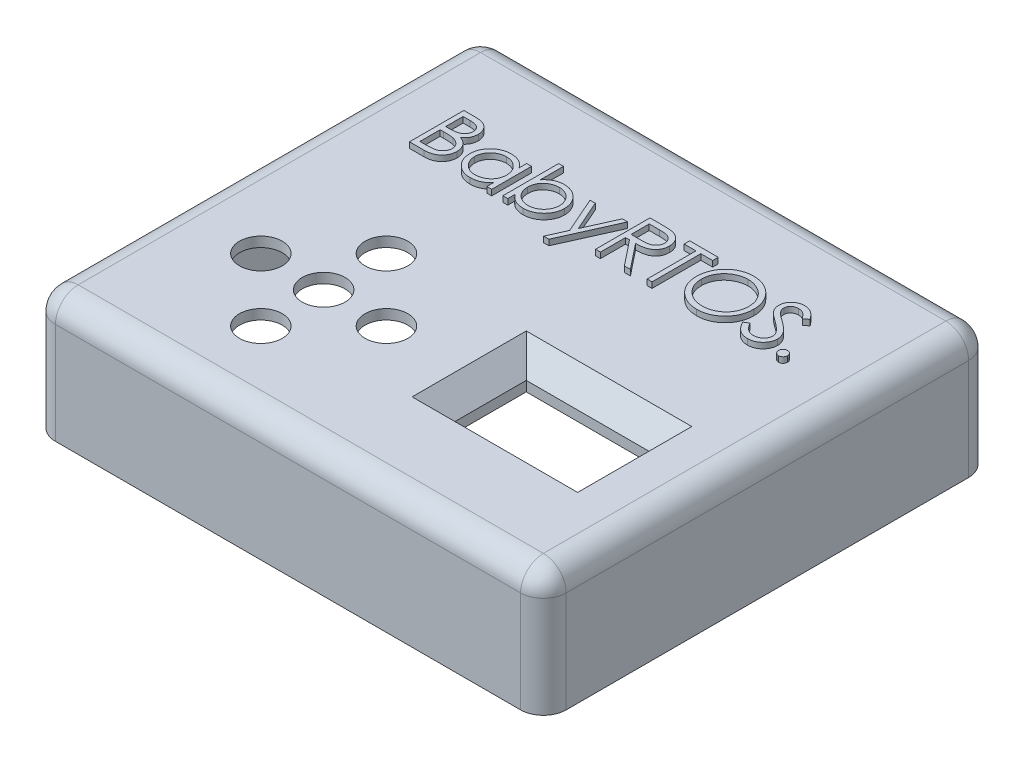
from build123d import *

# Parameters (mm, degrees)
SKETCH1_W               = 89.5
SKETCH1_H               = 78.5
BOSS_EXTRUDE1_DEPTH     = 21.75
FILLET2_R               = 4
SHELL1_T                = -1.75
CUT_EXTRUDE1_DEPTH      = 64.37339745
CUT_EXTRUDE1_DEPTH_BACK = 64.37339745
SKETCH3_W               = 22
SKETCH3_H               = 13
SKETCH3_4_R             = 3.75
CUT_EXTRUDE2_DEPTH      = 64.37339745
SKETCH6_W               = 12
SKETCH6_H               = 13
CUT_EXTRUDE3_DEPTH      = 64.37339745
BOSS_EXTRUDE2_REACH     = 65.373
SKETCH3_5_R             = 1.1
BOSS_EXTRUDE3_REACH     = 65.373
SKETCH7_R               = 1.1
FILLET3_R               = 2
BOSS_EXTRUDE4_DEPTH     = 1


with BuildPart() as part:
    # Sketch1 → Boss-Extrude1 (new body)
    with BuildSketch(Plane(origin=(0, 0, 0), x_dir=(1, 0, 0), z_dir=(0, 1, 0))):
        Rectangle(SKETCH1_W, SKETCH1_H)
    extrude(amount=BOSS_EXTRUDE1_DEPTH)

    # Fillet2
    fillet2_edges = [part.edges().sort_by_distance(p)[0] for p in [
        (44.75, 10.875, -39.25),
        (44.75, 21.75, 0),
        (0, 21.75, 39.25),
        (44.75, 10.875, 39.25),
        (-44.75, 10.875, 39.25),
        (-44.75, 21.75, 0),
        (0, 21.75, -39.25),
        (-44.75, 10.875, -39.25),
    ]]
    fillet(fillet2_edges, radius=FILLET2_R)

    # Sketch4 → Cut-Loft1 section 0
    with BuildSketch(Plane(origin=(0, 21.75, 0), x_dir=(1, 0, 0), z_dir=(0, 1, 0))):
        with BuildLine():
            Line((5.5, -23), (34.5, -23))
            Line((34.5, -23), (34.5, -3))
            Line((34.5, -3), (5.5, -3))
            Line((5.5, -3), (5.5, -23))
        make_face()
    # Sketch5 → Cut-Loft1 section 1
    with BuildSketch(Plane(origin=(0, 17.75, 0), x_dir=(1, 0, 0), z_dir=(0, 1, 0))):
        with BuildLine():
            Line((31, -19.5), (31, -6.5))
            Line((31, -6.5), (9, -6.5))
            Line((9, -6.5), (9, -19.5))
            Line((9, -19.5), (31, -19.5))
        make_face()
    loft(mode=Mode.SUBTRACT)

    # Shell1
    shell1_openings = [part.faces().sort_by_distance(p)[0] for p in [
        (0, 0, 0),
    ]]
    offset(amount=SHELL1_T, openings=shell1_openings, kind=Kind.INTERSECTION)

    # Sketch3 → Cut-Extrude1 (cut, two sides: drawn at the far end of the back side and taken through both)
    with BuildSketch(Plane(origin=(0, 0, 0), x_dir=(1, 0, 0), z_dir=(0, 1, 0)).offset(-CUT_EXTRUDE1_DEPTH_BACK)):
        with Locations((20, -13)):
            Rectangle(SKETCH3_W, SKETCH3_H)
    extrude(amount=CUT_EXTRUDE1_DEPTH + CUT_EXTRUDE1_DEPTH_BACK, mode=Mode.SUBTRACT)

    # Sketch3<4> → Cut-Extrude2 (cut, through all)
    with BuildSketch(Plane(origin=(0, 0, 0), x_dir=(1, 0, 0), z_dir=(0, 1, 0))):
        with Locations((-18.5, -3.5)):
            Circle(SKETCH3_4_R)
        with Locations((-29.5, -14.5)):
            Circle(SKETCH3_4_R)
        with Locations((-18.5, -14.5)):
            Circle(SKETCH3_4_R)
        with Locations((-7.5, -14.5)):
            Circle(SKETCH3_4_R)
        with Locations((-18.5, -25.5)):
            Circle(SKETCH3_4_R)
    extrude(amount=CUT_EXTRUDE2_DEPTH, mode=Mode.SUBTRACT)

    # Sketch6 → Cut-Extrude3 (cut, through all)
    with BuildSketch(Plane(origin=(0, 0, 0), x_dir=(0, 0, -1), z_dir=(1, 0, 0))):
        with Locations((28.5, 6.5)):
            Rectangle(SKETCH6_W, SKETCH6_H)
    extrude(amount=-CUT_EXTRUDE3_DEPTH, mode=Mode.SUBTRACT)

    # Sketch3<5> → Boss-Extrude2 (add, up to next)
    with BuildSketch(Plane(origin=(0, 0, 0), x_dir=(1, 0, 0), z_dir=(0, 1, 0)), mode=Mode.PRIVATE) as boss_extrude2_sk1:
        with BuildLine():
            Line((44.75, 32.125), (41.212355987, 32.125))
            ThreePointArc((41.212355987, 32.125), (36.484745674, 30.984745674), (37.625, 35.712355987))
            Line((37.625, 35.712355987), (37.625, 39.25))
            Line((37.625, 39.25), (39.375, 39.25))
            Line((39.375, 39.25), (39.375, 35.712355987))
            ThreePointArc((39.375, 35.712355987), (40.515254326, 35.015254326), (41.212355987, 33.875))
            Line((41.212355987, 33.875), (44.75, 33.875))
            Line((44.75, 33.875), (44.75, 32.125))
        make_face()
        with Locations((38.5, 33)):
            Circle(SKETCH3_5_R, mode=Mode.SUBTRACT)
    boss_extrude2_tool1 = extrude(boss_extrude2_sk1.sketch, amount=BOSS_EXTRUDE2_REACH, mode=Mode.PRIVATE) - part.part
    boss_extrude2 = boss_extrude2_tool1.solids().sort_by_distance((39.30816, 0, -33.80816))[0]
    add(boss_extrude2)

    # Mirror1: Boss-Extrude2 across plane
    add(boss_extrude2.mirror(Plane.XY))

    # Sketch7 → Boss-Extrude3 (add, up to next)
    with BuildSketch(Plane(origin=(0, 0, 0), x_dir=(1, 0, 0), z_dir=(0, 1, 0)), mode=Mode.PRIVATE) as boss_extrude3_sk1:
        with BuildLine():
            Line((-37.625, -35.712355987), (-37.625, -39.25))
            Line((-37.625, -39.25), (-39.375, -39.25))
            Line((-39.375, -39.25), (-39.375, -35.712355987))
            ThreePointArc((-39.375, -35.712355987), (-40.515254326, -35.015254326), (-41.212355987, -33.875))
            Line((-41.212355987, -33.875), (-44.75, -33.875))
            Line((-44.75, -33.875), (-44.75, -32.125))
            Line((-44.75, -32.125), (-41.212355987, -32.125))
            ThreePointArc((-41.212355987, -32.125), (-36.484745674, -30.984745674), (-37.625, -35.712355987))
        make_face()
        with Locations((-38.5, -33)):
            Circle(SKETCH7_R, mode=Mode.SUBTRACT)
    boss_extrude3_tool1 = extrude(boss_extrude3_sk1.sketch, amount=BOSS_EXTRUDE3_REACH, mode=Mode.PRIVATE) - part.part
    add(boss_extrude3_tool1.solids().sort_by_distance((-39.30816, 0, 33.80816))[0])

    # Fillet3
    fillet3_edges = [part.edges().sort_by_distance(p)[0] for p in [
        (-43.875, 0, -22.5),
        (-43.875, 0, -34.5),
    ]]
    fillet(fillet3_edges, radius=FILLET3_R)

    # Sketch8 → Boss-Extrude4 (add)
    # profile 1 of 9: a face of its own
    with BuildSketch(Plane(origin=(0, 21.75, 0), x_dir=(1, 0, 0), z_dir=(0, 1, 0))):
        with BuildLine():
            Line((-32.428807867, 23.991700279), (-30.570364358, 23.991700279))
            add(Edge.make_bspline(
                [(-30.570364358, 23.991700279), (-30.479391142, 23.991221987), (-30.303062409, 23.990294938), (-30.046650928, 23.975917274), (-29.806488093, 23.956313001), (-29.582504256, 23.92520682), (-29.374802916, 23.887673484), (-29.182758131, 23.842220684), (-29.006980591, 23.787719686), (-28.797123787, 23.701052306), (-28.557853988, 23.572265684), (-28.298778363, 23.381960089), (-28.07724254, 23.1491896), (-27.886235491, 22.886618945), (-27.73437673, 22.597778023), (-27.62451457, 22.289551231), (-27.554960638, 21.965914204), (-27.547807542, 21.743728127), (-27.544192483, 21.631438861)],
                knots=[0, 0, 0, 0, 1.001505555, 1.941167018, 2.826882275, 3.653841531, 4.429895133, 5.150066043, 5.825578002, 6.45369114, 7.647487171, 8.808567382, 9.977351308, 11.170798116, 12.373658725, 13.556498008, 14.765093433, 16, 16, 16, 16], degree=3))
            add(Edge.make_bspline(
                [(-27.544192483, 21.631438861), (-27.547167599, 21.526248692), (-27.553013982, 21.319540089), (-27.608919634, 21.017205406), (-27.696442596, 20.729411018), (-27.818104738, 20.45720724), (-27.976225171, 20.206744336), (-28.163618167, 19.976001847), (-28.389705751, 19.774749328), (-28.559096282, 19.662237572), (-28.645138997, 19.605086698)],
                knots=[0, 0, 0, 0, 1.044552857, 2.05264487, 3.044412934, 4.028983338, 5.005914585, 5.980388656, 6.974128949, 8, 8, 8, 8], degree=3))
            add(Edge.make_bspline(
                [(-28.645138997, 19.605086698), (-28.536933833, 19.563544093), (-28.329910551, 19.484062801), (-28.045015046, 19.343540574), (-27.799556217, 19.190699402), (-27.591646842, 19.023789152), (-27.413835081, 18.843878746), (-27.258569575, 18.648330185), (-27.126086693, 18.434592565), (-27.012567951, 18.204894373), (-26.923988836, 17.961581055), (-26.857651554, 17.706934872), (-26.819640139, 17.441868939), (-26.814230915, 17.261478014), (-26.811500175, 17.170411217)],
                knots=[0, 0, 0, 0, 1.27268992, 2.434971085, 3.483601985, 4.442670788, 5.356604649, 6.2567628, 7.179492994, 8.113709626, 9.066344395, 10.018646069, 10.999752585, 12, 12, 12, 12], degree=3))
            add(Edge.make_bspline(
                [(-26.811500175, 17.170411217), (-26.814158592, 17.077428515), (-26.819389101, 16.894482444), (-26.857978881, 16.625727399), (-26.923317951, 16.368892723), (-27.013318714, 16.12231719), (-27.13078187, 15.886477824), (-27.273732973, 15.661107441), (-27.444180299, 15.448470442), (-27.634851393, 15.24620401), (-27.85055766, 15.06433696), (-28.083282679, 14.902369216), (-28.335957307, 14.769166004), (-28.604431662, 14.657271688), (-28.891717408, 14.571799241), (-29.196524504, 14.512002451), (-29.518590068, 14.4717116), (-29.739596605, 14.468399064), (-29.852936473, 14.466700279)],
                knots=[0, 0, 0, 0, 0.978564426, 1.925352924, 2.850884081, 3.763762016, 4.682927383, 5.618979971, 6.567305752, 7.547517671, 8.540179244, 9.531824382, 10.526200242, 11.540722885, 12.589160233, 13.674978461, 14.80764778, 16, 16, 16, 16], degree=3))
            Line((-29.852936473, 14.466700279), (-32.428807867, 14.466700279))
            Line((-32.428807867, 14.466700279), (-32.428807867, 23.991700279))
        make_face()
        with BuildLine():
            Line((-31.574000175, 23.014777203), (-31.574000175, 19.961892587))
            Line((-31.574000175, 19.961892587), (-30.999676257, 19.961892587))
            add(Edge.make_bspline(
                [(-30.999676257, 19.961892587), (-30.915723464, 19.962980949), (-30.753509559, 19.965083886), (-30.518596126, 19.971107815), (-30.300541612, 19.987975347), (-30.099722409, 20.004838032), (-29.916454758, 20.032255302), (-29.751144678, 20.064891008), (-29.601197782, 20.099406629), (-29.428279447, 20.158106447), (-29.232138066, 20.244859263), (-29.023042261, 20.379493331), (-28.838707741, 20.539851749), (-28.68304968, 20.724884295), (-28.555655606, 20.928627272), (-28.467171853, 21.147829854), (-28.407171744, 21.377028928), (-28.401751934, 21.534377173), (-28.399000175, 21.614266385)],
                knots=[0, 0, 0, 0, 1.156816544, 2.235205308, 3.236616184, 4.169592532, 5.011045266, 5.787822928, 6.49130361, 7.128639758, 8.301311294, 9.436451833, 10.541879658, 11.654887649, 12.756523258, 13.837046038, 14.901820046, 16, 16, 16, 16], degree=3))
            add(Edge.make_bspline(
                [(-28.399000175, 21.614266385), (-28.400432137, 21.667132235), (-28.403241086, 21.770834372), (-28.426246145, 21.922007971), (-28.465346473, 22.064185612), (-28.515568514, 22.199315727), (-28.585750588, 22.323172976), (-28.668382585, 22.440039816), (-28.76822007, 22.545936367), (-28.881859614, 22.644913359), (-29.012511652, 22.732664538), (-29.160098239, 22.809519758), (-29.326616132, 22.871407157), (-29.509258973, 22.925607544), (-29.710838147, 22.963675686), (-29.929027467, 22.995389548), (-30.165614095, 23.011535082), (-30.329294696, 23.013672391), (-30.413904021, 23.014777203)],
                knots=[0, 0, 0, 0, 0.91205012, 1.789085906, 2.630437955, 3.453916878, 4.269457761, 5.079663411, 5.91843418, 6.774407191, 7.675494373, 8.627863946, 9.638891023, 10.736472738, 11.911756761, 13.175263542, 14.539845004, 16, 16, 16, 16], degree=3))
            Line((-30.413904021, 23.014777203), (-31.574000175, 23.014777203))
        make_face(mode=Mode.SUBTRACT)
        with BuildLine():
            Line((-31.574000175, 18.98496951), (-31.574000175, 15.443623356))
            Line((-31.574000175, 15.443623356), (-30.356662435, 15.443623356))
            add(Edge.make_bspline(
                [(-30.356662435, 15.443623356), (-30.269525215, 15.444667698), (-30.101579711, 15.446680527), (-29.859097078, 15.453251565), (-29.634353059, 15.468198401), (-29.428373204, 15.491727463), (-29.23893333, 15.517250243), (-29.068306009, 15.551570943), (-28.915108104, 15.590892757), (-28.737468738, 15.651673612), (-28.537434191, 15.746097579), (-28.321867503, 15.888467009), (-28.130207581, 16.05807544), (-27.96745184, 16.254374571), (-27.834066492, 16.467819825), (-27.737032718, 16.694093955), (-27.677186172, 16.929458141), (-27.669941269, 17.089931837), (-27.666307867, 17.170411217)],
                knots=[0, 0, 0, 0, 1.160039823, 2.235823828, 3.228722157, 4.157150951, 4.99529583, 5.772374946, 6.472645482, 7.099169577, 8.269452708, 9.405989375, 10.527446681, 11.663510218, 12.788923519, 13.866172445, 14.929861265, 16, 16, 16, 16], degree=3))
            add(Edge.make_bspline(
                [(-27.666307867, 17.170411217), (-27.667059265, 17.220739522), (-27.668549942, 17.320584333), (-27.691030615, 17.467312383), (-27.723725504, 17.609441367), (-27.765993192, 17.747357218), (-27.827550456, 17.878566478), (-27.899413982, 18.005664158), (-27.983673225, 18.12881827), (-28.114966276, 18.284517331), (-28.30593432, 18.463905773), (-28.577279187, 18.639539976), (-28.885813798, 18.781184365), (-29.109590047, 18.841326511), (-29.225187074, 18.87239439)],
                knots=[0, 0, 0, 0, 0.723448775, 1.435228256, 2.130040452, 2.821711965, 3.505591119, 4.210454504, 4.921174351, 5.648778258, 7.137944449, 8.670945889, 10.280296675, 12, 12, 12, 12], degree=3))
            add(Edge.make_bspline(
                [(-29.225187074, 18.87239439), (-29.271530542, 18.881797154), (-29.37201274, 18.902184286), (-29.535863369, 18.923704536), (-29.722923127, 18.942877164), (-29.933623957, 18.957058957), (-30.168232439, 18.971718051), (-30.427249625, 18.977418957), (-30.709617745, 18.984220514), (-30.905539845, 18.984713458), (-31.007308468, 18.98496951)],
                knots=[0, 0, 0, 0, 0.634451884, 1.375622551, 2.216452059, 3.157844607, 4.20941857, 5.370758133, 6.634282058, 8, 8, 8, 8], degree=3))
            Line((-31.007308468, 18.98496951), (-31.574000175, 18.98496951))
        make_face(mode=Mode.SUBTRACT)
    # profile 2 of 9: a face of its own
    with BuildSketch(Plane(origin=(0, 21.75, 0), x_dir=(1, 0, 0), z_dir=(0, 1, 0))):
        with BuildLine():
            Line((-18.019192483, 21.427277203), (-18.019192483, 14.466700279))
            Line((-18.019192483, 14.466700279), (-18.874000175, 14.466700279))
            Line((-18.874000175, 14.466700279), (-18.874000175, 15.67068165))
            add(Edge.make_bspline(
                [(-18.874000175, 15.67068165), (-18.970389884, 15.561716755), (-19.158495612, 15.349070392), (-19.472660369, 15.071261051), (-19.805676625, 14.841631476), (-20.155928077, 14.656166348), (-20.52309844, 14.516850824), (-20.906373791, 14.417828491), (-21.305910478, 14.354163839), (-21.578740101, 14.347806522), (-21.716998973, 14.344584895)],
                knots=[0, 0, 0, 0, 1.074387032, 2.096679803, 3.090159297, 4.057316773, 5.018401886, 5.985159533, 6.978961417, 8, 8, 8, 8], degree=3))
            add(Edge.make_bspline(
                [(-21.716998973, 14.344584895), (-21.839920333, 14.347922379), (-22.082326698, 14.354504047), (-22.438912972, 14.405564316), (-22.782064022, 14.48756265), (-23.112104109, 14.601592928), (-23.426897591, 14.752852164), (-23.729139711, 14.933939418), (-24.01726468, 15.149587677), (-24.286880797, 15.396116525), (-24.535162169, 15.663891455), (-24.753043204, 15.949493265), (-24.934706943, 16.251686963), (-25.086617305, 16.566646475), (-25.203628786, 16.896796363), (-25.28519989, 17.240994941), (-25.336200677, 17.59883524), (-25.342779624, 17.842510656), (-25.34611556, 17.96606927)],
                knots=[0, 0, 0, 0, 1.033919861, 2.038935746, 3.024066025, 3.998881131, 4.97069526, 5.957263378, 6.95902576, 7.993208707, 9.027059324, 10.027763471, 11.009749337, 11.988697705, 12.965288445, 13.950418724, 14.960734635, 16, 16, 16, 16], degree=3))
            add(Edge.make_bspline(
                [(-25.34611556, 17.96606927), (-25.342705687, 18.087074063), (-25.335964554, 18.326294012), (-25.285745434, 18.678116754), (-25.201296761, 19.016984307), (-25.082784404, 19.341805702), (-24.930814512, 19.652973981), (-24.745953076, 19.950709221), (-24.528186743, 20.235831653), (-24.277128407, 20.50163692), (-24.005163068, 20.747165877), (-23.714218593, 20.960550494), (-23.411532378, 21.144837061), (-23.092409471, 21.290851164), (-22.761573278, 21.408985942), (-22.416078544, 21.490718519), (-22.057362747, 21.538880515), (-21.813820766, 21.545854894), (-21.690286233, 21.549392587)],
                knots=[0, 0, 0, 0, 1.020392517, 2.01726096, 2.990465484, 3.961182959, 4.928053699, 5.906110375, 6.912531644, 7.948652711, 8.985773172, 9.998621852, 10.987621588, 11.969261332, 12.953316658, 13.946091881, 14.958173133, 16, 16, 16, 16], degree=3))
            add(Edge.make_bspline(
                [(-21.690286233, 21.549392587), (-21.548228045, 21.545479849), (-21.269658643, 21.537807154), (-20.862184561, 21.473955018), (-20.476709231, 21.366081761), (-20.110257031, 21.219349141), (-19.764143878, 21.024362243), (-19.44164647, 20.778399634), (-19.139389691, 20.483012547), (-18.964183326, 20.256125837), (-18.874000175, 20.139341505)],
                knots=[0, 0, 0, 0, 1.038897134, 2.037228247, 3.008116434, 3.962042015, 4.918381754, 5.904844433, 6.921570401, 8, 8, 8, 8], degree=3))
            Line((-18.874000175, 20.139341505), (-18.874000175, 21.427277203))
            Line((-18.874000175, 21.427277203), (-18.019192483, 21.427277203))
        make_face()
        with BuildLine():
            add(Edge.make_bspline(
                [(-21.678837915, 20.694584895), (-21.803790506, 20.690139066), (-22.050427046, 20.681363708), (-22.412496795, 20.612855839), (-22.758971157, 20.498869908), (-23.088117259, 20.342981305), (-23.394735763, 20.146960243), (-23.668766396, 19.909865622), (-23.912450462, 19.638166319), (-24.117396524, 19.333088433), (-24.284466376, 19.006032342), (-24.40194237, 18.664154407), (-24.479419393, 18.313620861), (-24.487334724, 18.075869552), (-24.491307867, 17.956529005)],
                knots=[0, 0, 0, 0, 1.031046209, 2.035121221, 3.029706178, 4.034933723, 5.034054252, 6.02443088, 7.017295772, 8.038157696, 9.050218397, 10.03989886, 11.016116709, 12, 12, 12, 12], degree=3))
            add(Edge.make_bspline(
                [(-24.491307867, 17.956529005), (-24.486232693, 17.837901642), (-24.476102238, 17.601111895), (-24.403302134, 17.250100468), (-24.281164765, 16.908141968), (-24.114498865, 16.578138836), (-23.905801694, 16.271749249), (-23.663897575, 15.994870772), (-23.386447167, 15.756774107), (-23.079123022, 15.557463282), (-22.750897046, 15.396456707), (-22.405727561, 15.284427359), (-22.050103145, 15.212097828), (-21.808297865, 15.203649216), (-21.686470127, 15.199392587)],
                knots=[0, 0, 0, 0, 0.979072187, 1.954306742, 2.945804271, 3.96968567, 4.997920485, 5.998718438, 6.996577872, 8.005894225, 9.015743152, 10.005417472, 10.995077863, 12, 12, 12, 12], degree=3))
            add(Edge.make_bspline(
                [(-21.686470127, 15.199392587), (-21.562790716, 15.20391006), (-21.316804634, 15.212894867), (-20.953660722, 15.281696024), (-20.60124943, 15.395366826), (-20.26437133, 15.552935163), (-19.950546716, 15.748217682), (-19.668884635, 15.97683698), (-19.430716178, 16.242729216), (-19.22880629, 16.534946564), (-19.070486049, 16.855291354), (-18.955162631, 17.196379402), (-18.886980216, 17.558222581), (-18.87838668, 17.805502267), (-18.874000175, 17.931724318)],
                knots=[0, 0, 0, 0, 1.01762866, 2.023962475, 3.030623092, 4.058876274, 5.077231937, 6.066672613, 7.034107872, 8.005628644, 8.981990164, 9.965428785, 10.961468474, 12, 12, 12, 12], degree=3))
            add(Edge.make_bspline(
                [(-18.874000175, 17.931724318), (-18.876611811, 18.0278937), (-18.881752338, 18.217185476), (-18.921024102, 18.49511822), (-18.983494295, 18.761093575), (-19.071522086, 19.015391178), (-19.187159081, 19.256605042), (-19.326626216, 19.486467132), (-19.492376047, 19.703781943), (-19.681740384, 19.905557015), (-19.889018542, 20.089597601), (-20.108350828, 20.253874571), (-20.342335846, 20.388826874), (-20.58703864, 20.500517763), (-20.842883771, 20.589397306), (-21.111953101, 20.648690959), (-21.39138663, 20.689404404), (-21.582011966, 20.692839883), (-21.678837915, 20.694584895)],
                knots=[0, 0, 0, 0, 1.050140795, 2.067009409, 3.05949893, 4.030605086, 5.00011959, 5.97591094, 6.962425594, 7.979863591, 8.993523472, 9.986985069, 10.967611495, 11.937549037, 12.921786183, 13.919465291, 14.943216303, 16, 16, 16, 16], degree=3))
        make_face(mode=Mode.SUBTRACT)
    # profile 3 of 9: a face of its own
    with BuildSketch(Plane(origin=(0, 21.75, 0), x_dir=(1, 0, 0), z_dir=(0, 1, 0))):
        with BuildLine():
            Line((-16.065346329, 14.466700279), (-16.065346329, 24.235931049))
            Line((-16.065346329, 24.235931049), (-15.210538636, 24.235931049))
            Line((-15.210538636, 24.235931049), (-15.210538636, 20.164146193))
            add(Edge.make_bspline(
                [(-15.210538636, 20.164146193), (-15.114217975, 20.275065993), (-14.926292393, 20.491475096), (-14.611215051, 20.774089058), (-14.280818465, 21.013717585), (-13.932589212, 21.211255522), (-13.566032015, 21.361678695), (-13.183039634, 21.471685342), (-12.782633016, 21.538052557), (-12.50962155, 21.545580227), (-12.371355944, 21.549392587)],
                knots=[0, 0, 0, 0, 1.077089805, 2.101446609, 3.097517232, 4.067117542, 5.031729543, 5.997785507, 6.985986182, 8, 8, 8, 8], degree=3))
            add(Edge.make_bspline(
                [(-12.371355944, 21.549392587), (-12.248439526, 21.546017395), (-12.00541282, 21.539344064), (-11.648137834, 21.488631616), (-11.304385278, 21.406396026), (-10.974342265, 21.292389453), (-10.659548818, 21.14112435), (-10.357309528, 20.960036934), (-10.069172877, 20.744395481), (-9.799602081, 20.49783865), (-9.551152291, 20.230168126), (-9.333676103, 19.943927411), (-9.149980501, 19.643277344), (-8.998039626, 19.329224317), (-8.880552689, 19.000485676), (-8.799611233, 18.657383749), (-8.74819402, 18.30025607), (-8.74171635, 18.057197655), (-8.738423252, 17.933632371)],
                knots=[0, 0, 0, 0, 1.034377878, 2.045141349, 3.03070803, 4.00595497, 4.978199603, 5.965204761, 6.967410914, 8.002051993, 9.036360596, 10.037508045, 11.022711142, 11.997267194, 12.969246472, 13.954813154, 14.960274251, 16, 16, 16, 16], degree=3))
            add(Edge.make_bspline(
                [(-8.738423252, 17.933632371), (-8.741788136, 17.811984466), (-8.748423159, 17.572113954), (-8.799099719, 17.219126826), (-8.882773482, 16.879387223), (-9.002410702, 16.553773037), (-9.152810285, 16.240754559), (-9.340891686, 15.943900031), (-9.55809162, 15.658043961), (-9.809364245, 15.392368221), (-10.081271843, 15.146804468), (-10.372231318, 14.933428507), (-10.674913834, 14.749141201), (-10.994037018, 14.603121733), (-11.324875759, 14.485009226), (-11.67097449, 14.403046082), (-12.030375132, 14.355222268), (-12.274538679, 14.348158617), (-12.398068685, 14.344584895)],
                knots=[0, 0, 0, 0, 1.024244038, 2.01964794, 2.996620209, 3.965911562, 4.936179293, 5.91563013, 6.920572822, 7.955171681, 8.990768464, 10.002129126, 10.989675881, 11.969873457, 12.952483066, 13.943799762, 14.959703725, 16, 16, 16, 16], degree=3))
            add(Edge.make_bspline(
                [(-12.398068685, 14.344584895), (-12.539488026, 14.348505407), (-12.816786696, 14.356192849), (-13.222422878, 14.419925928), (-13.606366237, 14.528406453), (-13.972990423, 14.674170945), (-14.31705444, 14.871552496), (-14.640742739, 15.116363367), (-14.942014061, 15.412637502), (-15.119496965, 15.638683414), (-15.210538636, 15.754635977)],
                knots=[0, 0, 0, 0, 1.035807596, 2.031038093, 2.998900396, 3.954262848, 4.914341711, 5.895762244, 6.92060972, 8, 8, 8, 8], degree=3))
            Line((-15.210538636, 15.754635977), (-15.210538636, 14.466700279))
            Line((-15.210538636, 14.466700279), (-16.065346329, 14.466700279))
        make_face()
        with BuildLine():
            add(Edge.make_bspline(
                [(-12.405700896, 15.199392587), (-12.280748265, 15.203838392), (-12.034111647, 15.212613702), (-11.672042474, 15.281121919), (-11.325565947, 15.395106543), (-10.996427988, 15.551000064), (-10.689779288, 15.747002887), (-10.415860334, 15.984164966), (-10.172347696, 16.25495123), (-9.96918822, 16.56038721), (-9.799571798, 16.88546449), (-9.683058524, 17.227423696), (-9.604899855, 17.577113087), (-9.597137528, 17.814274822), (-9.593230944, 17.933632371)],
                knots=[0, 0, 0, 0, 1.031910345, 2.036826888, 3.032245421, 4.038315463, 5.03827337, 6.029480047, 7.023177075, 8.037597977, 9.052889626, 10.043399556, 11.015292101, 12, 12, 12, 12], degree=3))
            add(Edge.make_bspline(
                [(-9.593230944, 17.933632371), (-9.598368304, 18.052873238), (-9.608622515, 18.290878933), (-9.680399602, 18.643711242), (-9.805742587, 18.985488992), (-9.972070922, 19.315266232), (-10.178540225, 19.622808889), (-10.420763597, 19.899007021), (-10.698027655, 20.137295264), (-11.005068532, 20.335932529), (-11.332130337, 20.498019598), (-11.676365561, 20.609176417), (-12.030581595, 20.681942484), (-12.271143615, 20.690349326), (-12.392344526, 20.694584895)],
                knots=[0, 0, 0, 0, 0.984795267, 1.965658976, 2.959410029, 3.983795688, 5.009594896, 6.01088574, 7.009236619, 8.019050059, 9.024672985, 10.014834719, 10.999826153, 12, 12, 12, 12], degree=3))
            add(Edge.make_bspline(
                [(-12.392344526, 20.694584895), (-12.5160811, 20.69035172), (-12.761673091, 20.681949726), (-13.124080896, 20.609048576), (-13.478038833, 20.497340433), (-13.816278473, 20.336962976), (-14.13156701, 20.140716787), (-14.413541333, 19.910102387), (-14.656650786, 19.64672278), (-14.856794905, 19.351431991), (-15.015739394, 19.032521287), (-15.129450879, 18.692309505), (-15.197485632, 18.332587505), (-15.206134693, 18.085935709), (-15.210538636, 17.960345111)],
                knots=[0, 0, 0, 0, 1.016820015, 2.018181405, 3.029022337, 4.06341356, 5.088169224, 6.076823655, 7.05054209, 8.02560866, 9.001194327, 9.972267242, 10.967515442, 12, 12, 12, 12], degree=3))
            add(Edge.make_bspline(
                [(-15.210538636, 17.960345111), (-15.207926962, 17.864175763), (-15.20278636, 17.674884051), (-15.163515142, 17.396950836), (-15.101042949, 17.130977206), (-15.01302244, 16.876673325), (-14.897358366, 16.6354828), (-14.757993285, 16.405532754), (-14.592117733, 16.188898118), (-14.404593372, 15.986109996), (-14.197867179, 15.801571518), (-13.976007835, 15.641610777), (-13.743549037, 15.503867874), (-13.49783133, 15.394072267), (-13.241714176, 15.304465093), (-12.972569404, 15.245318256), (-12.693156457, 15.204564758), (-12.502528285, 15.201134797), (-12.405700896, 15.199392587)],
                knots=[0, 0, 0, 0, 1.050331198, 2.067384183, 3.060053655, 4.031335885, 5.001026174, 5.976994447, 6.963687968, 7.976578778, 8.990422448, 9.985569286, 10.960374351, 11.936812464, 12.921228065, 13.919088064, 14.943024695, 16, 16, 16, 16], degree=3))
        make_face(mode=Mode.SUBTRACT)
    # profile 4 of 9: a face of its own
    with BuildSketch(Plane(origin=(0, 21.75, 0), x_dir=(1, 0, 0), z_dir=(0, 1, 0))):
        Polygon((-7.761500175, 21.427277203), (-6.839910632, 21.427277203), (-4.483465319, 16.096177443), (-2.090767002, 21.427277203), (-1.167269406, 21.427277203), (-5.441307867, 11.902277203), (-6.364805463, 11.902277203), (-4.94712217, 15.060104727), align=None)
    # profile 5 of 9: a face of its own
    with BuildSketch(Plane(origin=(0, 21.75, 0), x_dir=(1, 0, 0), z_dir=(0, 1, 0))):
        with BuildLine():
            Line((0.175999825, 23.991700279), (2.082144657, 23.991700279))
            add(Edge.make_bspline(
                [(2.082144657, 23.991700279), (2.209347299, 23.991276863), (2.453590464, 23.990463857), (2.803493435, 23.985930603), (3.121430035, 23.972937535), (3.407234026, 23.961756318), (3.660900166, 23.941367535), (3.883206293, 23.921880345), (4.073128527, 23.896370597), (4.188097594, 23.87267941), (4.240152469, 23.861952683)],
                knots=[0, 0, 0, 0, 1.410062039, 2.707475311, 3.878576406, 4.937260626, 5.877586885, 6.699081471, 7.410979367, 8, 8, 8, 8], degree=3))
            add(Edge.make_bspline(
                [(4.240152469, 23.861952683), (4.309839068, 23.844734843), (4.447725661, 23.810666466), (4.646254055, 23.738658553), (4.835432322, 23.655329432), (5.01447463, 23.557456736), (5.182484176, 23.444313942), (5.341193293, 23.317854266), (5.491322161, 23.178769656), (5.626799312, 23.023553409), (5.754540588, 22.860712622), (5.862278207, 22.684625969), (5.955150984, 22.500489955), (6.029093606, 22.306431911), (6.088632948, 22.104333803), (6.130614356, 21.892365007), (6.155790803, 21.67149121), (6.158353995, 21.520838616), (6.159653671, 21.444449679)],
                knots=[0, 0, 0, 0, 1.027469482, 2.033020251, 3.019912614, 3.986113645, 4.951240523, 5.91722682, 6.890402269, 7.87763091, 8.8651537, 9.85103654, 10.82876324, 11.815024772, 12.821070561, 13.842952187, 14.906261191, 16, 16, 16, 16], degree=3))
            add(Edge.make_bspline(
                [(6.159653671, 21.444449679), (6.155655898, 21.317535572), (6.147855206, 21.06989328), (6.075124746, 20.710499024), (5.955990074, 20.375248103), (5.791824552, 20.064562639), (5.582765836, 19.784498668), (5.331510511, 19.538507501), (5.037918412, 19.332658881), (4.764607202, 19.18991232), (4.523177844, 19.098491619), (4.3244229, 19.034166956), (4.107614911, 18.984468322), (3.874831165, 18.939945392), (3.625102931, 18.906331138), (3.359028752, 18.881711477), (3.076418868, 18.866324388), (2.882274687, 18.864032932), (2.782400065, 18.862854126)],
                knots=[0, 0, 0, 0, 1.260483769, 2.459530307, 3.627416485, 4.787058657, 5.939039949, 7.08810263, 8.267026773, 9.491475466, 10.141966685, 10.831826277, 11.566392101, 12.351337768, 13.187381173, 14.07005841, 15.007169909, 16, 16, 16, 16], degree=3))
            Line((2.782400065, 18.862854126), (6.281769056, 14.466700279))
            Line((6.281769056, 14.466700279), (5.224707758, 14.466700279))
            Line((5.224707758, 14.466700279), (1.725338767, 18.862854126))
            Line((1.725338767, 18.862854126), (1.030807517, 18.862854126))
            Line((1.030807517, 18.862854126), (1.030807517, 14.466700279))
            Line((1.030807517, 14.466700279), (0.175999825, 14.466700279))
            Line((0.175999825, 14.466700279), (0.175999825, 23.991700279))
        make_face()
        with BuildLine():
            Line((1.030807517, 23.014777203), (1.030807517, 19.839777203))
            Line((1.030807517, 19.839777203), (2.774767854, 19.826420832))
            add(Edge.make_bspline(
                [(2.774767854, 19.826420832), (2.856193103, 19.82638481), (3.014018426, 19.826314988), (3.242348092, 19.837183764), (3.454946396, 19.849548081), (3.651000158, 19.868460228), (3.830596959, 19.892833538), (3.993647034, 19.923321659), (4.140416539, 19.958841915), (4.311590419, 20.013819197), (4.502734122, 20.100921289), (4.710464738, 20.227645968), (4.887363957, 20.387037642), (5.036818996, 20.569301119), (5.156914092, 20.76969691), (5.241583326, 20.985822887), (5.295310972, 21.212222878), (5.301647942, 21.367829015), (5.304845979, 21.446357731)],
                knots=[0, 0, 0, 0, 1.146690395, 2.22261258, 3.21895312, 4.145990853, 4.996080663, 5.770904154, 6.481378293, 7.121626537, 8.300444488, 9.431385265, 10.535395872, 11.636531494, 12.74115979, 13.810798291, 14.895190096, 16, 16, 16, 16], degree=3))
            add(Edge.make_bspline(
                [(5.304845979, 21.446357731), (5.301574492, 21.522956621), (5.295091599, 21.674747671), (5.242163165, 21.896968398), (5.152657063, 22.106700598), (5.032037258, 22.303091089), (4.885082415, 22.481360271), (4.712767511, 22.633888594), (4.519804087, 22.759753209), (4.339451754, 22.840183344), (4.178250076, 22.889495231), (4.038287929, 22.924196612), (3.880141694, 22.952076203), (3.703043481, 22.974413854), (3.507749329, 22.993613381), (3.293271771, 23.006545007), (3.061033819, 23.014202737), (2.900069671, 23.014581258), (2.816745017, 23.014777203)],
                knots=[0, 0, 0, 0, 1.101028733, 2.181837193, 3.264309656, 4.369019818, 5.486613113, 6.575447106, 7.666700264, 8.788928104, 9.402425223, 10.0903467, 10.862060571, 11.710948788, 12.657782767, 13.684531032, 14.801375019, 16, 16, 16, 16], degree=3))
            Line((2.816745017, 23.014777203), (1.030807517, 23.014777203))
        make_face(mode=Mode.SUBTRACT)
    # profile 6 of 9: a face of its own
    with BuildSketch(Plane(origin=(0, 21.75, 0), x_dir=(1, 0, 0), z_dir=(0, 1, 0))):
        Polygon((7.136576748, 23.014777203), (7.136576748, 23.991700279), (12.143307517, 23.991700279), (12.143307517, 23.014777203), (10.067345979, 23.014777203), (10.067345979, 14.466700279), (9.212538287, 14.466700279), (9.212538287, 23.014777203), align=None)
    # profile 7 of 9: a face of its own
    with BuildSketch(Plane(origin=(0, 21.75, 0), x_dir=(1, 0, 0), z_dir=(0, 1, 0))):
        with BuildLine():
            add(Edge.make_bspline(
                [(18.065903671, 24.235931049), (18.242274302, 24.23146388), (18.588680773, 24.222689992), (19.097791745, 24.155527574), (19.58382554, 24.03933512), (20.050741417, 23.884586575), (20.492954447, 23.678154283), (20.913793147, 23.428639701), (21.312256211, 23.133428767), (21.68297297, 22.794803514), (22.022217956, 22.426367114), (22.321101261, 22.033180802), (22.571587789, 21.617621918), (22.77728911, 21.180939229), (22.938666041, 20.724120316), (23.050024295, 20.24472978), (23.121157404, 19.745873717), (23.129473484, 19.405622035), (23.133692133, 19.233016385)],
                knots=[0, 0, 0, 0, 1.065120563, 2.091984664, 3.0946048, 4.079830382, 5.057816894, 6.036188127, 7.030412546, 8.04752943, 9.064399622, 10.05169764, 11.02544977, 11.989514704, 12.962713494, 13.945757189, 14.957906945, 16, 16, 16, 16], degree=3))
            add(Edge.make_bspline(
                [(23.133692133, 19.233016385), (23.129474102, 19.061682192), (23.121159875, 18.723962648), (23.049943416, 18.228272275), (22.938253266, 17.751775451), (22.778787713, 17.295267639), (22.574066947, 16.858267269), (22.321912517, 16.441924201), (22.024892508, 16.046101945), (21.686872434, 15.675136763), (21.31838817, 15.334965075), (20.923154373, 15.038550135), (20.510059695, 14.783486624), (20.073788275, 14.579968197), (19.620126032, 14.417303185), (19.14501271, 14.306397813), (18.650674587, 14.234859503), (18.313568499, 14.226644827), (18.142225787, 14.22246951)],
                knots=[0, 0, 0, 0, 1.043624062, 2.057103931, 3.04512605, 4.022047818, 4.998200453, 5.980619268, 6.982898556, 8.009068085, 9.034988726, 10.034168286, 11.015286542, 11.987931943, 12.962482838, 13.94673481, 14.956375938, 16, 16, 16, 16], degree=3))
            add(Edge.make_bspline(
                [(18.142225787, 14.22246951), (17.969621033, 14.226686056), (17.629371117, 14.23499799), (17.129888185, 14.306248813), (16.650160896, 14.417667647), (16.191561126, 14.576896898), (15.753833139, 14.78268379), (15.336120842, 15.033611422), (14.940100877, 15.331355142), (14.569056553, 15.669265606), (14.229560521, 16.037125329), (13.933579648, 16.431281409), (13.68259559, 16.844000902), (13.477499664, 17.276429164), (13.315127099, 17.726475733), (13.204351844, 18.197142661), (13.132680432, 18.685746602), (13.124421314, 19.018421918), (13.120230594, 19.187223116)],
                knots=[0, 0, 0, 0, 1.053102029, 2.075944431, 3.073151272, 4.055350789, 5.033113405, 6.020478099, 7.024410459, 8.052272461, 9.079885166, 10.07527673, 11.055994387, 12.023226415, 12.992069828, 13.970394897, 14.97016774, 16, 16, 16, 16], degree=3))
            add(Edge.make_bspline(
                [(13.120230594, 19.187223116), (13.121685567, 19.300523451), (13.124577156, 19.525694787), (13.159388834, 19.860067464), (13.209903178, 20.189062754), (13.282298382, 20.511745119), (13.376981419, 20.827324656), (13.488701579, 21.137977804), (13.625153587, 21.440556366), (13.779405922, 21.736493739), (13.951568414, 22.021176683), (14.141730275, 22.290270406), (14.343212242, 22.546032975), (14.56409262, 22.781836607), (14.79709166, 23.004541058), (15.045989104, 23.210723881), (15.309266212, 23.402244283), (15.588055831, 23.574838211), (15.875488422, 23.730936999), (16.171788796, 23.864890751), (16.472932751, 23.979860389), (16.780330757, 24.073044349), (17.093166515, 24.146610104), (17.4121228, 24.196704403), (17.736945511, 24.231604868), (17.955779171, 24.234482784), (18.065903671, 24.235931049)],
                knots=[0, 0, 0, 0, 1.037015668, 2.060948919, 3.074880161, 4.083647147, 5.086022904, 6.090072063, 7.104153813, 8.122640571, 9.144368836, 10.147691507, 11.138137339, 12.123020368, 13.103399296, 14.087645067, 15.080126199, 16.082011238, 17.087798457, 18.072939717, 19.057185487, 20.037253025, 21.01195951, 21.997135196, 22.992090687, 24, 24, 24, 24], degree=3))
        make_face()
        with BuildLine():
            add(Edge.make_bspline(
                [(18.107880835, 23.259007972), (18.017489582, 23.257906092), (17.837571223, 23.255712866), (17.570096878, 23.226822954), (17.306140258, 23.185648042), (17.045646851, 23.126915475), (16.789706592, 23.046894446), (16.53593381, 22.954798831), (16.286642642, 22.842618578), (16.042656072, 22.715874289), (15.806122903, 22.575587583), (15.582931194, 22.420542989), (15.372503141, 22.254376495), (15.175353966, 22.076700309), (14.992062561, 21.886609607), (14.819021338, 21.686986191), (14.663166262, 21.472124259), (14.520330514, 21.247850223), (14.392510892, 21.014456206), (14.278849462, 20.774399367), (14.185874552, 20.525721519), (14.110049085, 20.271120562), (14.0471846, 20.010999725), (14.007359421, 19.743385736), (13.978152071, 19.469623324), (13.976084206, 19.284615564), (13.975038287, 19.191039222)],
                knots=[0, 0, 0, 0, 1.008559885, 2.007477868, 2.99961109, 3.989939068, 4.984837346, 5.991145699, 7.001802488, 8.033829008, 9.059044045, 10.069351652, 11.065060232, 12.050310815, 13.029377138, 14.011219647, 14.996725999, 15.989392538, 16.977580475, 17.965360261, 18.951710183, 19.937753436, 20.929683414, 21.935841486, 22.955955122, 24, 24, 24, 24], degree=3))
            add(Edge.make_bspline(
                [(13.975038287, 19.191039222), (13.978507732, 19.053437749), (13.985333205, 18.782733085), (14.045089164, 18.386035493), (14.137133252, 18.004795228), (14.272816513, 17.641098318), (14.442499257, 17.29181852), (14.652122437, 16.960054321), (14.90047752, 16.645716055), (15.182590403, 16.350998216), (15.490990055, 16.08199642), (15.818466984, 15.845876001), (16.161512873, 15.64609525), (16.521022303, 15.483340017), (16.895075963, 15.354372231), (17.286084156, 15.265983956), (17.691442192, 15.207812181), (17.967750618, 15.202225752), (18.107880835, 15.199392587)],
                knots=[0, 0, 0, 0, 1.032063989, 2.030389145, 3.003944642, 3.970395727, 4.937377036, 5.913328081, 6.909231446, 7.93887556, 8.970685674, 9.976071282, 10.964166581, 11.944589148, 12.933237628, 13.927779006, 14.949070134, 16, 16, 16, 16], degree=3))
            add(Edge.make_bspline(
                [(18.107880835, 15.199392587), (18.202068121, 15.200686638), (18.388869799, 15.20325313), (18.66671547, 15.229103101), (18.939555589, 15.270555546), (19.207007465, 15.330238258), (19.468767559, 15.40493387), (19.725928416, 15.493673473), (19.975750906, 15.604384463), (20.221386608, 15.726707102), (20.456507808, 15.866153531), (20.680959078, 16.015935924), (20.889082995, 16.18185767), (21.086084682, 16.356894003), (21.270128607, 16.544574189), (21.4399702, 16.744654221), (21.59503756, 16.95839701), (21.737819069, 17.182330864), (21.865190806, 17.416363523), (21.976168211, 17.657290718), (22.070319069, 17.904519195), (22.1463245, 18.158405543), (22.205884221, 18.418467567), (22.246923146, 18.685053479), (22.275629968, 18.957629976), (22.277793714, 19.141990041), (22.27888444, 19.234924438)],
                knots=[0, 0, 0, 0, 1.047197238, 2.076906641, 3.100256066, 4.114471768, 5.12198147, 6.126382909, 7.136867548, 8.15857795, 9.17633901, 10.174870724, 11.156907918, 12.133735059, 13.104061851, 14.077631395, 15.04955518, 16.038496417, 17.029181396, 18.010275684, 18.986308667, 19.968651475, 20.955262928, 21.950658345, 22.966943676, 24, 24, 24, 24], degree=3))
            add(Edge.make_bspline(
                [(22.27888444, 19.234924438), (22.27779284, 19.32722306), (22.27562745, 19.51031438), (22.246936858, 19.780989893), (22.205840864, 20.045657561), (22.146615208, 20.303278339), (22.070278718, 20.553917897), (21.976151769, 20.797340832), (21.86515749, 21.034453991), (21.737772251, 21.264671328), (21.594582045, 21.485582579), (21.438115569, 21.696772002), (21.2656713, 21.894273533), (21.08217619, 22.082962951), (20.883046852, 22.258815922), (20.669185308, 22.421890782), (20.443187871, 22.576123049), (20.20390018, 22.715257614), (19.956946992, 22.843747776), (19.703544006, 22.953832292), (19.446561957, 23.04737356), (19.186654337, 23.127157586), (18.921633517, 23.185418011), (18.65329024, 23.226860061), (18.381995765, 23.255702811), (18.199542431, 23.257902755), (18.107880835, 23.259007972)],
                knots=[0, 0, 0, 0, 1.02996197, 2.043119294, 3.035359645, 4.018872909, 4.991431989, 5.957985074, 6.929999688, 7.912076566, 8.892894881, 9.867085534, 10.843653904, 11.817741046, 12.803660682, 13.806313499, 14.818574707, 15.856120519, 16.894564902, 17.924820532, 18.937903209, 19.946497019, 20.957711757, 21.963978472, 22.977135795, 24, 24, 24, 24], degree=3))
        make_face(mode=Mode.SUBTRACT)
    # profile 8 of 9: a face of its own
    with BuildSketch(Plane(origin=(0, 21.75, 0), x_dir=(1, 0, 0), z_dir=(0, 1, 0))):
        with BuildLine():
            Line((24.11061521, 16.304155207), (24.915813527, 16.786892587))
            add(Edge.make_bspline(
                [(24.915813527, 16.786892587), (24.990702444, 16.661531654), (25.134186719, 16.421344943), (25.373540061, 16.096792705), (25.621551769, 15.820942835), (25.880058455, 15.595400068), (26.147482214, 15.417829883), (26.425568818, 15.29209381), (26.713381145, 15.213673191), (26.90925276, 15.204147955), (27.007039489, 15.199392587)],
                knots=[0, 0, 0, 0, 1.272034388, 2.437168799, 3.508375237, 4.49857839, 5.41946034, 6.295179144, 7.148887113, 8, 8, 8, 8], degree=3))
            add(Edge.make_bspline(
                [(27.007039489, 15.199392587), (27.090551587, 15.201718517), (27.25611452, 15.206329679), (27.499851767, 15.250636719), (27.736566529, 15.318705442), (27.961380036, 15.416189548), (28.171190244, 15.534132141), (28.355177036, 15.676588524), (28.514233958, 15.836081127), (28.644343049, 16.014015351), (28.744165145, 16.205378449), (28.820887845, 16.401800145), (28.863464796, 16.606366034), (28.869878532, 16.744098794), (28.87311521, 16.813605328)],
                knots=[0, 0, 0, 0, 1.095163259, 2.171163733, 3.241058638, 4.321873601, 5.38011039, 6.391990106, 7.366004449, 8.327778327, 9.272591725, 10.192022065, 11.087607919, 12, 12, 12, 12], degree=3))
            add(Edge.make_bspline(
                [(28.87311521, 16.813605328), (28.869102978, 16.892910069), (28.860946699, 17.054125018), (28.792008885, 17.291976931), (28.683562006, 17.527360282), (28.583515097, 17.672960155), (28.531573743, 17.748551241)],
                knots=[0, 0, 0, 0, 0.938893495, 1.908633276, 2.914225137, 4, 4, 4, 4], degree=3))
            add(Edge.make_bspline(
                [(28.531573743, 17.748551241), (28.488927286, 17.80310724), (28.399396384, 17.917640734), (28.245479153, 18.088125268), (28.064868513, 18.263979679), (27.863745268, 18.45191897), (27.634783076, 18.643202188), (27.385153197, 18.846950859), (27.108482267, 19.055416579), (26.91444578, 19.195223347), (26.814326147, 19.267361337)],
                knots=[0, 0, 0, 0, 0.722233717, 1.516239348, 2.393582979, 3.351407094, 4.387010283, 5.505090956, 6.712668013, 8, 8, 8, 8], degree=3))
            add(Edge.make_bspline(
                [(26.814326147, 19.267361337), (26.714112272, 19.338740565), (26.522510973, 19.475212213), (26.254562974, 19.677752586), (26.014956257, 19.862929116), (25.804755791, 20.032485035), (25.624054031, 20.186443338), (25.471427034, 20.323325587), (25.350762818, 20.446833706), (25.283664416, 20.526956214), (25.253538888, 20.562929246)],
                knots=[0, 0, 0, 0, 1.452282411, 2.77665338, 3.964542531, 5.026858415, 5.96415736, 6.766646006, 7.446254459, 8, 8, 8, 8], degree=3))
            add(Edge.make_bspline(
                [(25.253538888, 20.562929246), (25.211431461, 20.618993496), (25.128621555, 20.729251369), (25.01931264, 20.901585446), (24.926405347, 21.077997332), (24.853573572, 21.258961078), (24.792242862, 21.441936134), (24.750991636, 21.629309882), (24.725161478, 21.820241551), (24.722516286, 21.94872972), (24.721192133, 22.013049438)],
                knots=[0, 0, 0, 0, 1.068054152, 2.10047183, 3.106115577, 4.101338837, 5.06977816, 6.043150881, 7.020423561, 8, 8, 8, 8], degree=3))
            add(Edge.make_bspline(
                [(24.721192133, 22.013049438), (24.724744166, 22.113823325), (24.73177231, 22.313217127), (24.791209717, 22.604493887), (24.885025235, 22.882586922), (25.016456323, 23.144743045), (25.185885262, 23.384136178), (25.381953235, 23.603520025), (25.615483065, 23.787947381), (25.871712704, 23.949088768), (26.15217326, 24.075215893), (26.44606279, 24.170359704), (26.753848393, 24.224269184), (26.962318352, 24.232005565), (27.068097181, 24.235931049)],
                knots=[0, 0, 0, 0, 1.005424448, 1.989358655, 2.955360095, 3.929531133, 4.905563448, 5.876582895, 6.856512386, 7.866279853, 8.892233794, 9.918561126, 10.94386622, 12, 12, 12, 12], degree=3))
            add(Edge.make_bspline(
                [(27.068097181, 24.235931049), (27.180340054, 24.232059676), (27.403555304, 24.224360752), (27.731893526, 24.157420327), (28.048016619, 24.046656356), (28.302315789, 23.920957223), (28.501341376, 23.79541387), (28.653122884, 23.68105992), (28.80693109, 23.549410517), (28.964006653, 23.400114997), (29.121688019, 23.231803482), (29.282316128, 23.045628678), (29.446266603, 22.842728337), (29.551737908, 22.69788166), (29.605807517, 22.623626361)],
                knots=[0, 0, 0, 0, 1.286793592, 2.559021753, 3.825965368, 5.121522368, 5.803751409, 6.523245864, 7.299691795, 8.125521123, 9.008227632, 9.944561021, 10.946284179, 12, 12, 12, 12], degree=3))
            Line((29.605807517, 22.623626361), (28.833046099, 22.037854126))
            add(Edge.make_bspline(
                [(28.833046099, 22.037854126), (28.786384669, 22.097966919), (28.696525663, 22.213730104), (28.560101845, 22.375849184), (28.431518025, 22.523939746), (28.304834437, 22.652568416), (28.186741769, 22.768779222), (28.072123246, 22.868273989), (27.962628333, 22.952027573), (27.824605884, 23.041408976), (27.651202665, 23.130009175), (27.433530462, 23.204982023), (27.206056385, 23.250035441), (27.05112646, 23.255992343), (26.972694537, 23.259007972)],
                knots=[0, 0, 0, 0, 1.181633172, 2.275549214, 3.290209073, 4.226197932, 5.078386478, 5.862611352, 6.581680152, 7.217281963, 8.414376989, 9.595101626, 10.782541182, 12, 12, 12, 12], degree=3))
            add(Edge.make_bspline(
                [(26.972694537, 23.259007972), (26.874297143, 23.255710417), (26.68454704, 23.249351393), (26.415152183, 23.179900576), (26.17268943, 23.070548513), (25.964357092, 22.917291323), (25.790901462, 22.735714907), (25.665428749, 22.526766737), (25.589908659, 22.296037484), (25.58069314, 22.135087691), (25.575999825, 22.053118549)],
                knots=[0, 0, 0, 0, 1.14458467, 2.207223713, 3.21896685, 4.227309161, 5.202851033, 6.127160689, 7.046193047, 8, 8, 8, 8], degree=3))
            add(Edge.make_bspline(
                [(25.575999825, 22.053118549), (25.577069691, 22.002087739), (25.579211173, 21.899942675), (25.609078301, 21.749035591), (25.647448617, 21.598509731), (25.708252494, 21.449041845), (25.792195784, 21.298017911), (25.902427727, 21.142837325), (26.041256812, 20.982132318), (26.14760211, 20.877609394), (26.203749224, 20.822424438)],
                knots=[0, 0, 0, 0, 0.858281714, 1.717966888, 2.583508476, 3.4729293, 4.427298488, 5.488583878, 6.674047936, 8, 8, 8, 8], degree=3))
            add(Edge.make_bspline(
                [(26.203749224, 20.822424438), (26.224599102, 20.803817961), (26.274133639, 20.759613229), (26.364691694, 20.687244237), (26.484278881, 20.597973835), (26.629772442, 20.487518353), (26.803855048, 20.359389517), (27.00654584, 20.215225615), (27.23558544, 20.050346616), (27.398114369, 19.935073594), (27.48405271, 19.874122154)],
                knots=[0, 0, 0, 0, 0.420754252, 0.999615792, 1.744751191, 2.668019286, 3.750313428, 4.999500688, 6.413464383, 8, 8, 8, 8], degree=3))
            add(Edge.make_bspline(
                [(27.48405271, 19.874122154), (27.587428659, 19.798898169), (27.787601859, 19.653237347), (28.072419987, 19.434391817), (28.330666707, 19.220357533), (28.563248711, 19.012501331), (28.772463726, 18.812399878), (28.955990666, 18.617645794), (29.115699554, 18.429634343), (29.287637284, 18.188590404), (29.463326778, 17.892550454), (29.614206881, 17.529843247), (29.709343526, 17.165726118), (29.721784579, 16.920996656), (29.727922902, 16.800248957)],
                knots=[0, 0, 0, 0, 1.163667725, 2.253281268, 3.268753668, 4.215851969, 5.092017293, 5.902905408, 6.650798638, 7.335211899, 8.59617414, 9.77448103, 10.901945474, 12, 12, 12, 12], degree=3))
            add(Edge.make_bspline(
                [(29.727922902, 16.800248957), (29.726134548, 16.714854978), (29.722592567, 16.545725313), (29.681877509, 16.297381139), (29.622224706, 16.056178558), (29.532316234, 15.825099031), (29.422579639, 15.59991507), (29.28333435, 15.386533569), (29.121932722, 15.18023187), (28.93678369, 14.986511083), (28.734184485, 14.808676078), (28.52005243, 14.650481989), (28.294037044, 14.518578909), (28.057364425, 14.410944118), (27.809980209, 14.326760759), (27.551967597, 14.265765737), (27.282901285, 14.228330552), (27.100019974, 14.224445001), (27.007039489, 14.22246951)],
                knots=[0, 0, 0, 0, 0.983748083, 1.948392443, 2.894712957, 3.844097841, 4.80183111, 5.778335162, 6.776009319, 7.81870978, 8.863265674, 9.881300176, 10.883814829, 11.87499822, 12.874611388, 13.892143829, 14.928324115, 16, 16, 16, 16], degree=3))
            add(Edge.make_bspline(
                [(27.007039489, 14.22246951), (26.935097591, 14.223860654), (26.79211983, 14.226625423), (26.580639025, 14.251067336), (26.373430572, 14.285648811), (26.173094561, 14.340551101), (25.977049891, 14.407163446), (25.786149203, 14.489182765), (25.600299978, 14.587473149), (25.418460699, 14.699854609), (25.241093838, 14.830640328), (25.069863, 14.982968201), (24.899150002, 15.152637039), (24.733993588, 15.344254358), (24.571053103, 15.554724426), (24.413541145, 15.786016418), (24.258197328, 16.036870503), (24.16072809, 16.2133962), (24.11061521, 16.304155207)],
                knots=[0, 0, 0, 0, 0.915332311, 1.819136955, 2.706846663, 3.586547465, 4.459518054, 5.340707479, 6.227863349, 7.133153174, 8.059268498, 9.028702269, 10.047606654, 11.120612155, 12.245963614, 13.433783089, 14.680604001, 16, 16, 16, 16], degree=3))
        make_face()
    # profile 9 of 9: a face of its own
    with BuildSketch(Plane(origin=(0, 21.75, 0), x_dir=(1, 0, 0), z_dir=(0, 1, 0))):
        with BuildLine():
            add(Edge.make_bspline(
                [(32.353403671, 15.932084895), (32.406444891, 15.928933027), (32.510426003, 15.922754158), (32.660755345, 15.880363353), (32.79681224, 15.805092285), (32.918003564, 15.704772866), (33.017897618, 15.583136812), (33.095851176, 15.448165089), (33.137872714, 15.296577183), (33.144006574, 15.191993568), (33.147153671, 15.138334895)],
                knots=[0, 0, 0, 0, 1.020151414, 1.999887582, 2.974338812, 3.990962822, 5.007586832, 5.987933904, 6.967670073, 8, 8, 8, 8], degree=3))
            add(Edge.make_bspline(
                [(33.147153671, 15.138334895), (33.143899929, 15.085965547), (33.137483598, 14.982693963), (33.0959475, 14.832249412), (33.01730352, 14.697193336), (32.918692575, 14.573906803), (32.796782281, 14.473374862), (32.660433685, 14.398744188), (32.510778904, 14.353318157), (32.406503766, 14.347531591), (32.353403671, 14.344584895)],
                knots=[0, 0, 0, 0, 1.009421747, 1.99056486, 2.972319754, 3.999869655, 5.017953583, 5.993804169, 6.978383603, 8, 8, 8, 8], degree=3))
            add(Edge.make_bspline(
                [(32.353403671, 14.344584895), (32.300265314, 14.34742497), (32.19652532, 14.352969541), (32.04742915, 14.399676892), (31.910250186, 14.472675023), (31.788363627, 14.574094255), (31.688926787, 14.696558931), (31.613746281, 14.833179535), (31.568597375, 14.982263303), (31.562659565, 15.085880724), (31.559653671, 15.138334895)],
                knots=[0, 0, 0, 0, 1.022052826, 1.995314843, 2.982371812, 4.00089066, 5.028879526, 6.005146991, 6.990147033, 8, 8, 8, 8], degree=3))
            add(Edge.make_bspline(
                [(31.559653671, 15.138334895), (31.562544098, 15.192081421), (31.568187303, 15.297014917), (31.613841064, 15.447235345), (31.688343469, 15.583765169), (31.789051009, 15.704587291), (31.9102207, 15.805789879), (32.047098229, 15.87944478), (32.196884407, 15.923097616), (32.300325739, 15.929037179), (32.353403671, 15.932084895)],
                knots=[0, 0, 0, 0, 1.032775665, 2.016367738, 2.991239715, 4.008302682, 5.025365648, 6.011011707, 6.979408107, 8, 8, 8, 8], degree=3))
        make_face()
    extrude(amount=BOSS_EXTRUDE4_DEPTH)


solid = part.part
